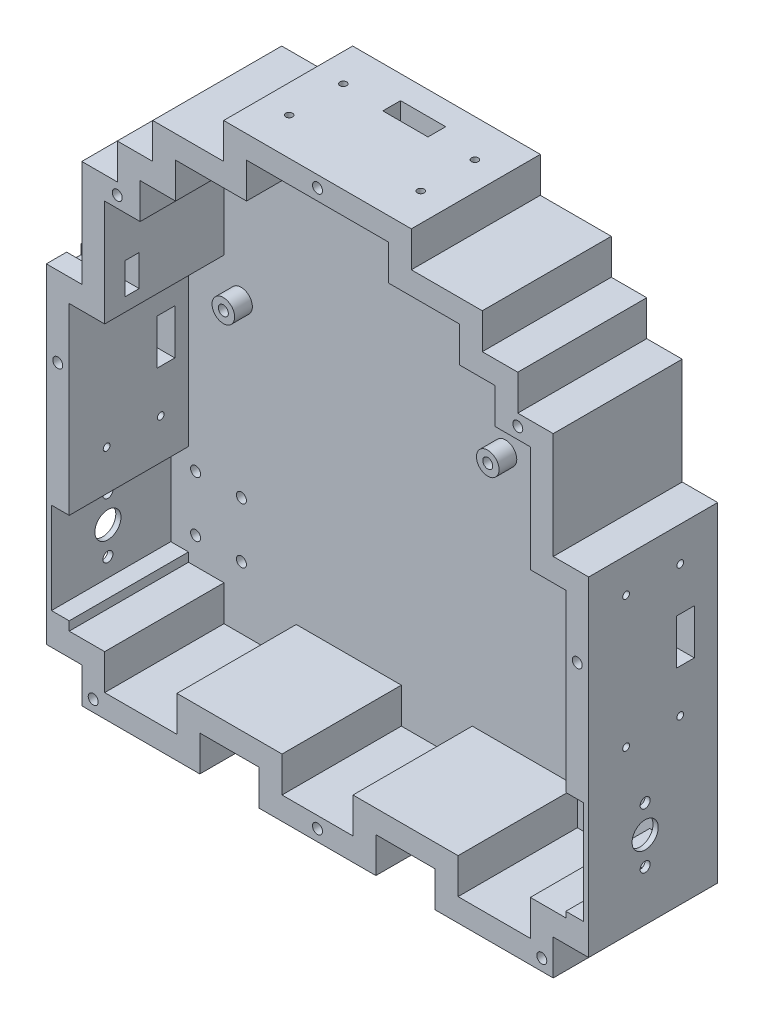
from build123d import *

# Parameters (mm, degrees)
SALIENTE_EXTRUIR3_DEPTH    = 3
SALIENTE_EXTRUIR4_DEPTH    = 37
CROQUIS15_R                = 1.05
CROQUIS15_W                = 14
CROQUIS15_H                = 5.5
CORTAR_EXTRUIR6_DEPTH      = 9
CROQUIS17_W                = 2.75
CROQUIS17_H                = 14
CROQUIS17_R                = 1.05
CORTAR_EXTRUIR7_DEPTH      = 205.947432284
CORTAR_EXTRUIR8_DEPTH      = 200.161793525
CORTAR_EXTRUIR8_DEPTH_BACK = 200.161793525
CROQUIS18_R                = 4.05
CROQUIS18_R_2              = 1.55
CROQUIS20_R                = 1.55
CROQUIS20_R_2              = 4.05
CORTAR_EXTRUIR9_DEPTH      = 5.5
CROQUIS21_W                = 38.703075187
CROQUIS21_H                = 31.902541418
CROQUIS21_R                = 1.55
CROQUIS21_R_2              = 4.05
CORTAR_EXTRUIR11_DEPTH     = 5.5
CROQUIS24_R                = 1.55
CORTAR_EXTRUIR12_DEPTH     = 5.5
SALIENTE_EXTRUIR5_START    = 5.5
CROQUIS25_R                = 3.5
CROQUIS25_R_2              = 1.55
SALIENTE_EXTRUIR5_DEPTH    = 5.5
CROQUIS27_W                = 4.4
CROQUIS27_H                = 9.7
CORTAR_EXTRUIR13_DEPTH     = 191.373895269
CROQUIS28_R                = 1.55
CORTAR_EXTRUIR14_DEPTH     = 5.5


with BuildPart() as part:
    # PacmanSilueta → Saliente-Extruir3 (new body)
    with BuildSketch(Plane.XY):
        Polygon((-79.1, 2.1), (-79.1, -93), (-79.1, -100.1), (-68.1, -100.1), (-68.1, -111.1), (-31.486400432, -111.1), (-31.486400432, -100.1), (-13.1, -100.1), (-13.1, -111.1), (23.1, -111.1), (23.1, -100.1), (41.486400432, -100.1), (41.486400432, -111.1), (78.1, -111.1), (78.1, -100.1), (89.1, -100.1), (89.1, 2.1), (78.1, 2.1), (78.1, 35.1), (67.1, 35.1), (67.1, 46.1), (56.1, 46.1), (56.1, 57.1), (34.1, 57.1), (34.1, 68.1), (-24.1, 68.1), (-24.1, 57.1), (-46.1, 57.1), (-46.1, 46.1), (-57.1, 46.1), (-57.1, 35.1), (-68.1, 35.1), (-68.1, 2.1), align=None)
    extrude(amount=-SALIENTE_EXTRUIR3_DEPTH)

    # Croquis3 → Saliente-Extruir4 (add)
    with BuildSketch(Plane.XY):
        Polygon((-46.1, 46.1), (-57.1, 46.1), (-57.1, 35.1), (-68.1, 35.1), (-68.1, 2.1), (-79.1, 2.1), (-79.1, -100.1), (-68.1, -100.1), (-68.1, -111.1), (-31.486400432, -111.1), (-31.486400432, -100.1), (-13.1, -100.1), (-13.1, -111.1), (23.1, -111.1), (23.1, -100.1), (41.486400432, -100.1), (41.486400432, -111.1), (78.1, -111.1), (78.1, -100.1), (89.1, -100.1), (89.1, 2.1), (78.1, 2.1), (78.1, 35.1), (67.1, 35.1), (67.1, 46.1), (56.1, 46.1), (56.1, 57.1), (34.1, 57.1), (34.1, 68.1), (-24.1, 68.1), (-24.1, 57.1), (-46.1, 57.1), align=None)
        Polygon((-72, -93), (-72, -5), (-61, -5), (-61, 28), (-50, 28), (-50, 39), (-39, 39), (-39, 50), (-17, 50), (-17, 61), (27, 61), (27, 50), (49, 50), (49, 39), (60, 39), (60, 28), (71, 28), (71, -5), (82, -5), (82, -93), (71, -93), (71, -104), (48.586400432, -104), (48.586400432, -93), (16, -93), (16, -104), (-6, -104), (-6, -93), (-38.586400432, -93), (-38.586400432, -104), (-61, -104), (-61, -93), align=None, mode=Mode.SUBTRACT)
    extrude(amount=SALIENTE_EXTRUIR4_DEPTH)

    # Croquis15 → Cortar-Extruir6 (cut)
    with BuildSketch(Plane(origin=(0, 68.1, 0), x_dir=(1, 0, 0), z_dir=(0, 1, 0))):
        with Locations(Location((-15.4, -8.6, 0), (0, 0, 180))):
            Circle(CROQUIS15_R)
        with Locations((-15.4, -25.4)):
            Circle(CROQUIS15_R)
        with Locations(Location((25.4, -8.6, 0), (0, 0, 180))):
            Circle(CROQUIS15_R)
        with Locations(Location((25.4, -25.4, 0), (0, 0, 180))):
            Circle(CROQUIS15_R)
        with Locations((5, -7)):
            Rectangle(CROQUIS15_W, CROQUIS15_H)
    extrude(amount=-CORTAR_EXTRUIR6_DEPTH, mode=Mode.SUBTRACT)

    # Croquis17 → Cortar-Extruir7 (cut, through all)
    with BuildSketch(Plane.ZY.offset(79.1)):
        with Locations((8.375, -29)):
            Rectangle(CROQUIS17_W, CROQUIS17_H)
        with Locations((5.625, -29)):
            Rectangle(CROQUIS17_W, CROQUIS17_H)
        with Locations((25.4, -8.6)):
            Circle(CROQUIS17_R)
        with Locations(Location((8.6, -8.6, 0), (0, 0, 180))):
            Circle(CROQUIS17_R)
        with Locations(Location((25.4, -49.4, 0), (0, 0, 180))):
            Circle(CROQUIS17_R)
        with Locations((8.6, -49.4)):
            Circle(CROQUIS17_R)
    extrude(amount=-CORTAR_EXTRUIR7_DEPTH, mode=Mode.SUBTRACT)

    # Croquis18 → Cortar-Extruir8 (cut, two sides: drawn at the far end of the back side and taken through both)
    with BuildSketch(Plane(origin=(-72, 0, 0), x_dir=(0, 0, -1), z_dir=(1, 0, 0)).offset(-CORTAR_EXTRUIR8_DEPTH_BACK)):
        with Locations((-19.5, -75.903746181)):
            Circle(CROQUIS18_R)
        with Locations((-19.5, -67.303746181)):
            Circle(CROQUIS18_R_2)
        with Locations((-19.5, -84.503746181)):
            Circle(CROQUIS18_R_2)
    extrude(amount=CORTAR_EXTRUIR8_DEPTH + CORTAR_EXTRUIR8_DEPTH_BACK, mode=Mode.SUBTRACT)

    # Croquis20 → Cortar-Extruir9 (cut)
    with BuildSketch(Plane(origin=(-72, 0, 0), x_dir=(0, 0, -1), z_dir=(1, 0, 0))):
        Polygon((0, -90.222340764), (0, -75.903746181), (0, -64.555188751), (0, -61.906996068), (-39.638162785, -61.906996068), (-39.638162785, -90.222340764), align=None)
        with Locations((-19.5, -84.503746181)):
            Circle(CROQUIS20_R, mode=Mode.SUBTRACT)
        with Locations((-19.5, -75.903746181)):
            Circle(CROQUIS20_R_2, mode=Mode.SUBTRACT)
        with Locations((-19.5, -67.303746181)):
            Circle(CROQUIS20_R, mode=Mode.SUBTRACT)
    extrude(amount=-CORTAR_EXTRUIR9_DEPTH, mode=Mode.SUBTRACT)

    # Croquis21 → Cortar-Extruir11 (cut)
    with BuildSketch(Plane.ZY.offset(-82)):
        with Locations((19.351537594, -75.274989688)):
            Rectangle(CROQUIS21_W, CROQUIS21_H)
        with Locations(Location((19.5, -84.503746181, 0), (0, 0, 270))):
            Circle(CROQUIS21_R, mode=Mode.SUBTRACT)
        with Locations(Location((19.5, -75.903746181, 0), (0, 0, 180))):
            Circle(CROQUIS21_R_2, mode=Mode.SUBTRACT)
        with Locations(Location((19.5, -67.303746181, 0), (0, 0, 180))):
            Circle(CROQUIS21_R, mode=Mode.SUBTRACT)
    extrude(amount=-CORTAR_EXTRUIR11_DEPTH, mode=Mode.SUBTRACT)

    # Croquis24 → Cortar-Extruir12 (cut)
    with BuildSketch(Plane.XY):
        with Locations((26.294334913, 22.504861365)):
            Circle(CROQUIS24_R)
        with Locations((-55.705665087, -14.495138635)):
            Circle(CROQUIS24_R)
        with Locations((65.6, -67.464668416)):
            Circle(CROQUIS24_R)
        with Locations((26.294334913, -14.495138635)):
            Circle(CROQUIS24_R)
        with Locations((-55.705665087, 22.504861365)):
            Circle(CROQUIS24_R)
        with Locations((-69.8, -67.464668416)):
            Circle(CROQUIS24_R)
        with Locations((-55.6, -67.464668416)):
            Circle(CROQUIS24_R)
        with Locations((-55.6, -84.664668416)):
            Circle(CROQUIS24_R)
        with Locations((-69.8, -84.664668416)):
            Circle(CROQUIS24_R)
        with Locations((79.8, -67.464668416)):
            Circle(CROQUIS24_R)
        with Locations((79.8, -84.664668416)):
            Circle(CROQUIS24_R)
        with Locations((65.6, -84.664668416)):
            Circle(CROQUIS24_R)
    extrude(amount=-CORTAR_EXTRUIR12_DEPTH, mode=Mode.SUBTRACT)

    # Croquis25 → Saliente-Extruir5 (add)
    # profile 1 of 4: a face of its own
    with BuildSketch(Plane.XY.offset(SALIENTE_EXTRUIR5_START)):
        with Locations((-55.705665087, -14.495138635)):
            Circle(CROQUIS25_R)
        with Locations((-55.705665087, -14.495138635)):
            Circle(CROQUIS25_R_2, mode=Mode.SUBTRACT)
    # profile 2 of 4: a face of its own
    with BuildSketch(Plane.XY.offset(SALIENTE_EXTRUIR5_START)):
        with Locations((-55.705665087, 22.504861365)):
            Circle(CROQUIS25_R)
        with Locations((-55.705665087, 22.504861365)):
            Circle(CROQUIS25_R_2, mode=Mode.SUBTRACT)
    # profile 3 of 4: a face of its own
    with BuildSketch(Plane.XY.offset(SALIENTE_EXTRUIR5_START)):
        with Locations((26.294334913, 22.504861365)):
            Circle(CROQUIS25_R)
        with Locations((26.294334913, 22.504861365)):
            Circle(CROQUIS25_R_2, mode=Mode.SUBTRACT)
    # profile 4 of 4: a face of its own
    with BuildSketch(Plane.XY.offset(SALIENTE_EXTRUIR5_START)):
        with Locations((26.294334913, -14.495138635)):
            Circle(CROQUIS25_R)
        with Locations((26.294334913, -14.495138635)):
            Circle(CROQUIS25_R_2, mode=Mode.SUBTRACT)
    extrude(amount=-SALIENTE_EXTRUIR5_DEPTH)

    # Croquis27 → Cortar-Extruir13 (cut, through all)
    with BuildSketch(Plane(origin=(-61, 0, 0), x_dir=(0, 0, -1), z_dir=(1, 0, 0))):
        with Locations((-28.5, 4)):
            Rectangle(CROQUIS27_W, CROQUIS27_H)
    extrude(amount=-CORTAR_EXTRUIR13_DEPTH, mode=Mode.SUBTRACT)

    # Croquis28 → Cortar-Extruir14 (cut)
    with BuildSketch(Plane.XY.offset(37)):
        with Locations((5, -107.55)):
            Circle(CROQUIS28_R)
        with Locations((5, 64.55)):
            Circle(CROQUIS28_R)
        with Locations((85.55, -22.670703526)):
            Circle(CROQUIS28_R)
        with Locations((-75.55, -22.670703526)):
            Circle(CROQUIS28_R)
        with Locations((-57.1, 31.55)):
            Circle(CROQUIS28_R)
        with Locations((67.1, 31.55)):
            Circle(CROQUIS28_R)
        with Locations((-64.55, -107.55)):
            Circle(CROQUIS28_R)
        with Locations((74.55, -107.55)):
            Circle(CROQUIS28_R)
    extrude(amount=-CORTAR_EXTRUIR14_DEPTH, mode=Mode.SUBTRACT)


solid = part.part
